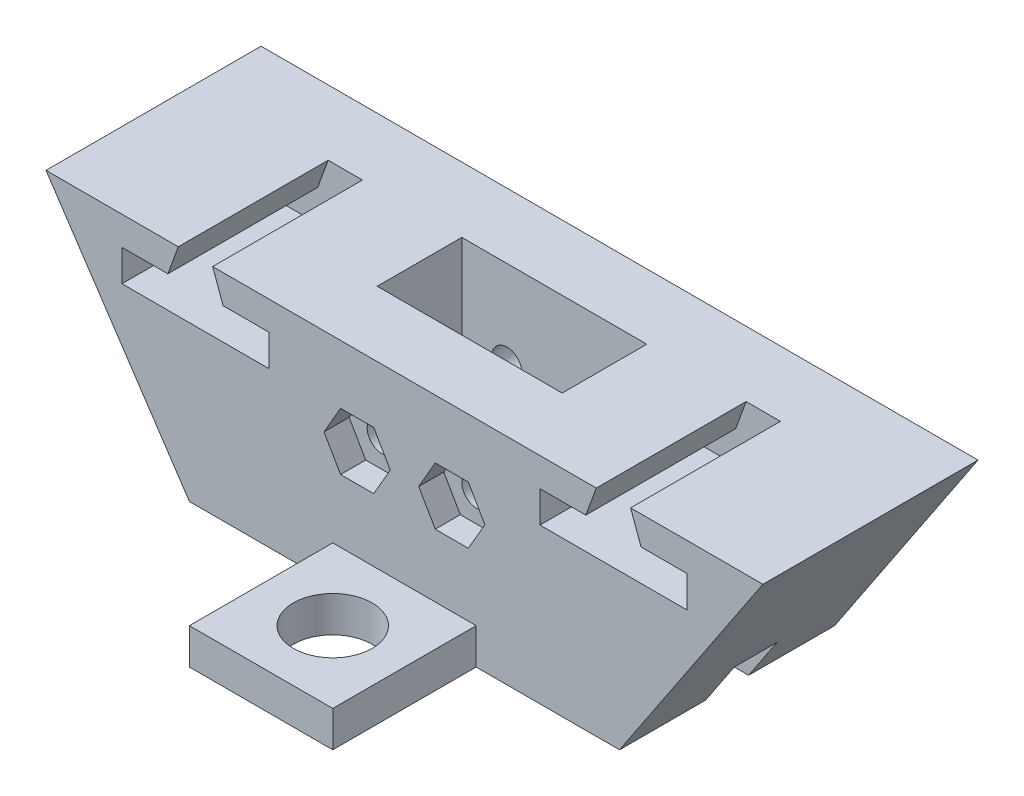
from build123d import *

# Parameters (mm, degrees)
SKETCH1_W                = 20
SKETCH1_H                = 15
SWITCHCASE_DEPTH         = 15
SKETCH2_W                = 12.9
SKETCH2_H                = 5.9
SWITCHCAVITY_DEPTH       = 30.154759474
SWITCHM2HOLES_DEPTH      = 28.096171316
SWITCHM2HOLES_DEPTH_BACK = 28.096171316
SKETCH3_R                = 1.05
NUTINSERTS_DEPTH         = 30.154759474
NUTINSERTS_DEPTH_BACK    = 1.75
SKETCH4_W                = 10
SKETCH4_H                = 10
MOUNTTABS_DEPTH          = 2.5
M5SCREWHOLES_REACH       = 36.369
SKETCH6_R                = 2.75
WINGS_DEPTH              = 15
WIRECHANNEL_DEPTH        = 43.884758365
WIRECHANNEL_DEPTH_BACK   = 43.884758365
SKETCH8_W                = 3
SKETCH8_H                = 3
BUMPERCHANNEL_DEPTH      = 46.552167896
BUMPERCHANNEL_DEPTH_BACK = 10.45


with BuildPart() as part:
    # Sketch1 → SwitchCase (new body)
    with BuildSketch(Plane.XY):
        with Locations((10, 7.5)):
            Rectangle(SKETCH1_W, SKETCH1_H)
    extrude(amount=SWITCHCASE_DEPTH)

    # Sketch2 → SwitchCavity (cut, through all)
    with BuildSketch(Plane(origin=(0, 15, 0), x_dir=(1, 0, 0), z_dir=(0, 1, 0))):
        with Locations((10, -7.5)):
            Rectangle(SKETCH2_W, SKETCH2_H)
    extrude(amount=-SWITCHCAVITY_DEPTH, mode=Mode.SUBTRACT)

    # Sketch3 → SwitchM2Holes (cut, two sides: drawn at the far end of the back side and taken through both)
    with BuildSketch(Plane.XY.offset(4.55).offset(-SWITCHM2HOLES_DEPTH_BACK)):
        with Locations((6.7, 8.9)):
            Circle(SKETCH3_R)
        with Locations((13.3, 8.9)):
            Circle(SKETCH3_R)
    extrude(amount=SWITCHM2HOLES_DEPTH + SWITCHM2HOLES_DEPTH_BACK, mode=Mode.SUBTRACT)

    # Sketch5 → NutInserts (cut, two sides: drawn at the far end of the back side and taken through both)
    with BuildSketch(Plane.XY.offset(15).offset(-NUTINSERTS_DEPTH_BACK)):
        Polygon((9.009401077, 8.9), (7.854700538, 10.9), (5.545299462, 10.9), (4.390598923, 8.9), (5.545299462, 6.9), (7.854700538, 6.9), align=None)
        Polygon((15.609401077, 8.9), (14.454700538, 10.9), (12.145299462, 10.9), (10.990598923, 8.9), (12.145299462, 6.9), (14.454700538, 6.9), align=None)
    extrude(amount=NUTINSERTS_DEPTH + NUTINSERTS_DEPTH_BACK, mode=Mode.SUBTRACT)

    # Sketch4 → MountTabs (add)
    with BuildSketch(Plane.XZ):
        with Locations((10, 20)):
            Rectangle(SKETCH4_W, SKETCH4_H)
        with Locations((10, -5)):
            Rectangle(SKETCH4_W, SKETCH4_H)
    extrude(amount=-MOUNTTABS_DEPTH)

    # Sketch6 → M5ScrewHoles (cut, up to next)
    with BuildSketch(Plane(origin=(0, 2.5, 0), x_dir=(1, 0, 0), z_dir=(0, 1, 0)), mode=Mode.PRIVATE) as m5screwholes_sk1:
        with Locations(Location((10, -20, 0), (0, 0, 270))):
            Circle(SKETCH6_R)
    m5screwholes_tool1 = extrude(m5screwholes_sk1.sketch, amount=-M5SCREWHOLES_REACH, mode=Mode.PRIVATE) & part.part
    # Sketch6 → M5ScrewHoles (cut, up to next)
    with BuildSketch(Plane(origin=(0, 2.5, 0), x_dir=(1, 0, 0), z_dir=(0, 1, 0)), mode=Mode.PRIVATE) as m5screwholes_sk2:
        with Locations(Location((10, 5, 0), (0, 0, 270))):
            Circle(SKETCH6_R)
    m5screwholes_tool2 = extrude(m5screwholes_sk2.sketch, amount=-M5SCREWHOLES_REACH, mode=Mode.PRIVATE) & part.part
    add(m5screwholes_tool1.solids().sort_by_distance((10, 2.5, 20))[0], mode=Mode.SUBTRACT)
    add(m5screwholes_tool2.solids().sort_by_distance((10, 2.5, -5))[0], mode=Mode.SUBTRACT)

    # Sketch7 → Wings (add)
    with BuildSketch(Plane.XY.offset(15)):
        Polygon((0, 15), (-15, 15), (-5, 0), (0, 0), align=None)
        Polygon((20, 15), (35, 15), (25, 0), (20, 0), align=None)
    extrude(amount=-WINGS_DEPTH)

    # Sketch8 → WireChannel (cut, two sides: drawn at the far end of the back side and taken through both)
    with BuildSketch(Plane.ZY.offset(-16.45).offset(-WIRECHANNEL_DEPTH_BACK)):
        with Locations((7.5, 1.5)):
            Rectangle(SKETCH8_W, SKETCH8_H)
    extrude(amount=WIRECHANNEL_DEPTH + WIRECHANNEL_DEPTH_BACK, mode=Mode.SUBTRACT)

    # Sketch9 → BumperChannel (cut, two sides: drawn at the far end of the back side and taken through both)
    with BuildSketch(Plane.XY.offset(15).offset(-BUMPERCHANNEL_DEPTH_BACK)):
        Polygon((-9.7, 10.8), (0.55, 10.8), (0.55, 13), (-2.65, 13), (-3.377940469, 15), (-5.772059531, 15), (-6.5, 13), (-9.7, 13), align=None)
        Polygon((26.5, 13), (29.7, 13), (29.7, 10.8), (19.45, 10.8), (19.45, 13), (22.65, 13), (23.377940469, 15), (25.772059531, 15), align=None)
    extrude(amount=BUMPERCHANNEL_DEPTH + BUMPERCHANNEL_DEPTH_BACK, mode=Mode.SUBTRACT)


solid = part.part
